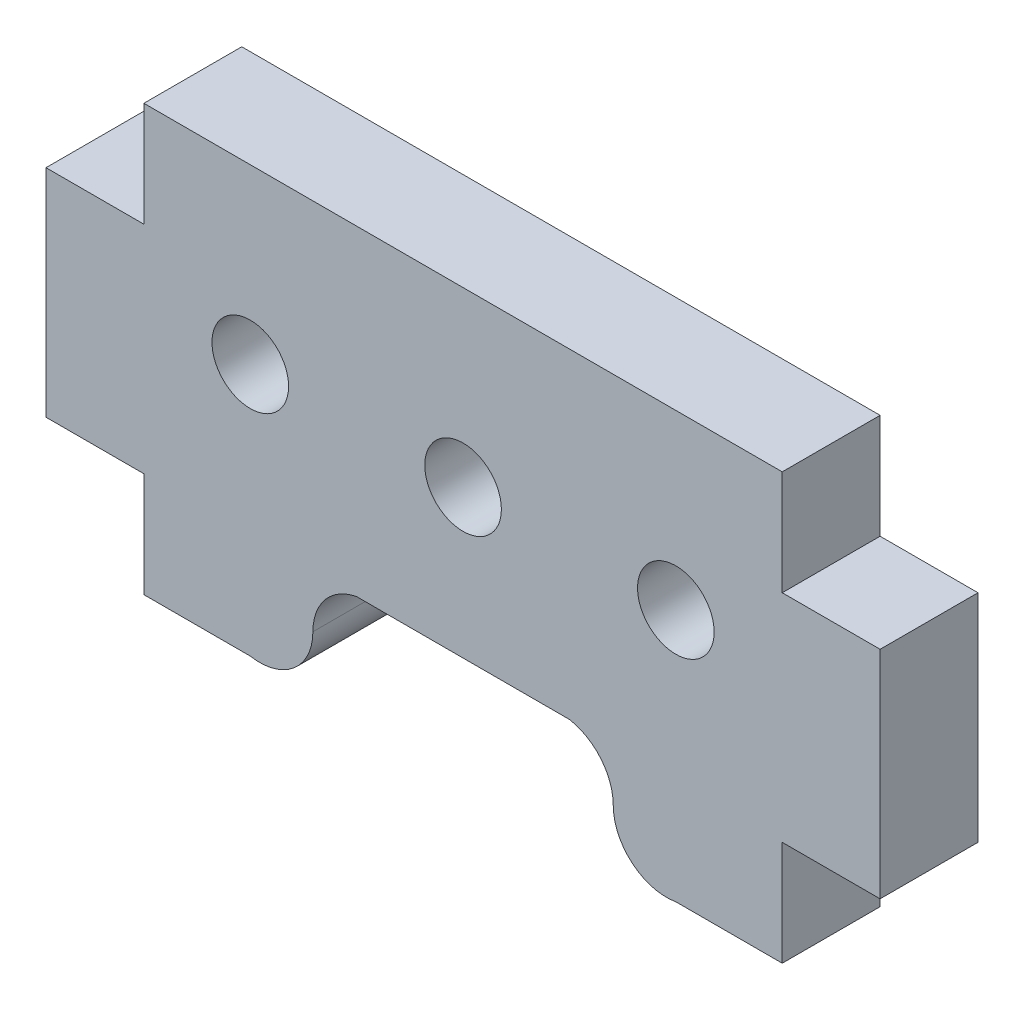
from build123d import *

# Parameters (mm, degrees)
SKETCH1_R           = 2.286
BOSS_EXTRUDE1_DEPTH = 5.842


with BuildPart() as part:
    # Sketch1 → Boss-Extrude1 (new body)
    with BuildSketch(Plane.XY):
        with BuildLine():
            Line((0, 0), (-6.35, 0))
            ThreePointArc((-6.35, 0), (-8.948239117, 0.689575054), (-10.086248608, 3.125))
            ThreePointArc((-10.086248608, 3.125), (-10.825823663, 5.161990509), (-12.7, 6.25))
            Line((-12.7, 6.25), (-25.4, 6.25))
            ThreePointArc((-25.4, 6.25), (-27.274176337, 5.161990509), (-28.013751392, 3.125))
            ThreePointArc((-28.013751392, 3.125), (-29.151760883, 0.689575054), (-31.75, 0))
            Line((-31.75, 0), (-38.1, 0))
            Line((-38.1, 0), (-38.1, 6.25))
            Line((-38.1, 6.25), (-43.942, 6.25))
            Line((-43.942, 6.25), (-43.942, 19.15))
            Line((-43.942, 19.15), (-38.1, 19.15))
            Line((-38.1, 19.15), (-38.1, 25.4))
            Line((-38.1, 25.4), (0, 25.4))
            Line((0, 25.4), (0, 19.15))
            Line((0, 19.15), (5.842, 19.15))
            Line((5.842, 19.15), (5.842, 6.25))
            Line((5.842, 6.25), (0, 6.25))
            Line((0, 6.25), (0, 0))
        make_face()
        with Locations((-6.35, 15.08125)):
            Circle(SKETCH1_R, mode=Mode.SUBTRACT)
        with Locations((-19.05, 15.08125)):
            Circle(SKETCH1_R, mode=Mode.SUBTRACT)
        with Locations((-31.75, 15.08125)):
            Circle(SKETCH1_R, mode=Mode.SUBTRACT)
    extrude(amount=BOSS_EXTRUDE1_DEPTH)


solid = part.part
